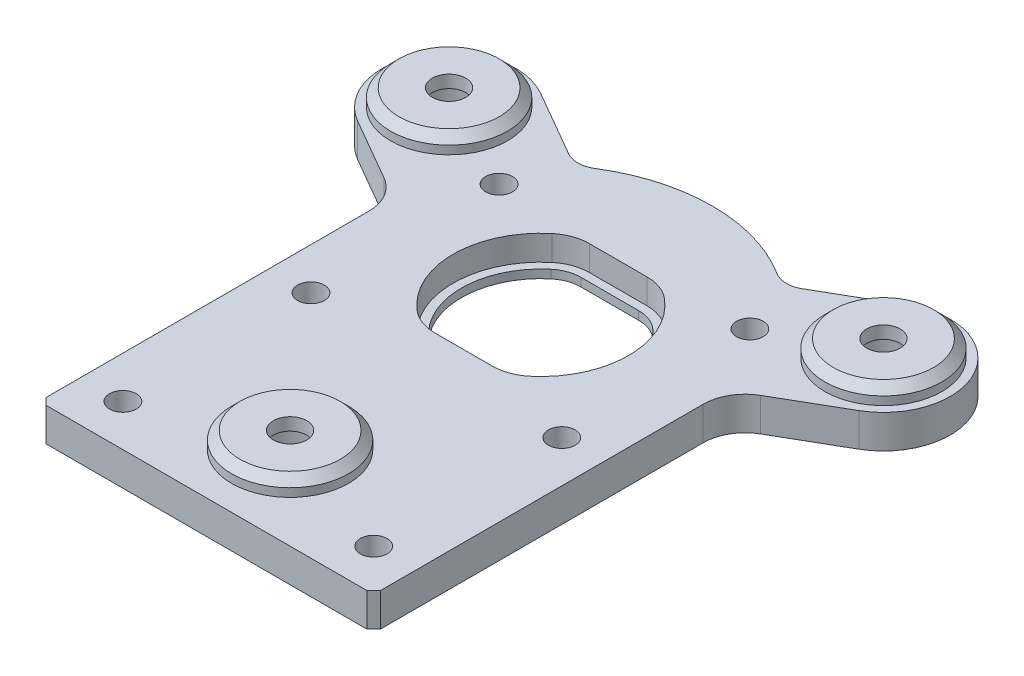
from build123d import *

# Parameters (mm, degrees)
BOSS_EXTRUDE1_DEPTH                                = 4
CUT_EXTRUDE1_DEPTH                                 = 3
CUT_EXTRUDE2_DEPTH                                 = 58.329679868
F_3_2_3_2_DIAMETER_HOLE1_D                         = 3.2
F_3_2_3_2_DIAMETER_HOLE1_DEPTH                     = 6
CBORE_FOR_M3_5_HEX_HEAD_MACHINE_SCREW1_D           = 4
CBORE_FOR_M3_5_HEX_HEAD_MACHINE_SCREW1_CBORE_D     = 8
CBORE_FOR_M3_5_HEX_HEAD_MACHINE_SCREW1_CBORE_DEPTH = 4.5
CHAMFER1_SIZE                                      = 1.55
CHAMFER2_SIZE                                      = 0.799999982
CHAMFER2_SIZE2                                     = 0.800000027
CHAMFER3_SIZE                                      = 0.799999997
CHAMFER3_SIZE2                                     = 0.800000017
FILLET1_R                                          = 3
FILLET2_R                                          = 4.1
FILLET3_R                                          = 5
FILLET4_R                                          = 5.100000015


with BuildPart() as part:
    # Sketch1 → Boss-Extrude1 (new body)
    with BuildSketch(Plane(origin=(0, 4, 0), x_dir=(1, 0, 0), z_dir=(0, 1, 0))):
        with BuildLine():
            Line((19.999999925, -16.999999746), (19.999999925, 25.309401343))
            Line((19.999999925, 25.309401343), (29.980761952, 31.071796677))
            ThreePointArc((29.980761952, 31.071796677), (32.90896539, 41.999999919), (21.980762114, 44.92820323))
            Line((21.980762114, 44.92820323), (12.345871038, 39.365496274))
            ThreePointArc((12.345871038, 39.365496274), (0, 43.5), (-12.345871038, 39.365496274))
            Line((-12.345871038, 39.365496274), (-21.980762114, 44.92820323))
            ThreePointArc((-21.980762114, 44.92820323), (-32.908965409, 41.999999887), (-29.980761888, 31.071796639))
            Line((-29.980761888, 31.071796639), (-19.999999289, 25.3094011))
            Line((-19.999999289, 25.3094011), (-19.999999289, -16.999999746))
            Line((-19.999999289, -16.999999746), (19.999999925, -16.999999746))
        make_face()
    extrude(amount=-BOSS_EXTRUDE1_DEPTH)

    # Sketch2 → Cut-Extrude1 (cut)
    with BuildSketch(Plane(origin=(0, 4, 0), x_dir=(-1, 0, 0), z_dir=(0, 1, 0))):
        with BuildLine():
            Line((-4.968651732, -32.250000015), (4.968651732, -32.250000015))
            ThreePointArc((4.968651732, -32.250000015), (10.500000015, -23), (4.968651732, -13.749999985))
            Line((4.968651732, -13.749999985), (-4.968651732, -13.749999985))
            ThreePointArc((-4.968651732, -13.749999985), (-10.500000015, -23), (-4.968651732, -32.250000015))
        make_face()
    extrude(amount=-CUT_EXTRUDE1_DEPTH, mode=Mode.SUBTRACT)

    # Sketch3 → Cut-Extrude2 (cut, through all)
    with BuildSketch(Plane.XZ):
        with BuildLine():
            Line((4.71036092, -14.75), (-4.71036092, -14.75))
            ThreePointArc((-4.71036092, -14.75), (-9.5, -23), (-4.71036092, -31.25))
            Line((-4.71036092, -31.25), (4.71036092, -31.25))
            ThreePointArc((4.71036092, -31.25), (9.5, -23), (4.71036092, -14.75))
        make_face()
    extrude(amount=-CUT_EXTRUDE2_DEPTH, mode=Mode.SUBTRACT)

    # Sketch4 → Revolve1 (revolve)
    with BuildSketch(Plane(origin=(0, 0, -38), x_dir=(-1, 0, 0), z_dir=(0, 0, -1)), mode=Mode.PRIVATE) as revolve1_sk:
        Polygon((18.980762114, 4), (25.980762114, 4), (25.980762114, 6), (19.980762114, 6), (18.980762114, 5), align=None)
    revolve(revolve1_sk.sketch.rotate(Axis((-25.980762114, 4, -38), (0, 1, 0)), 270), axis=Axis((-25.980762114, 4, -38), (0, 1, 0)))

    # Sketch5 → Revolve2 (revolve)
    with BuildSketch(Plane(origin=(0, 0, 7), x_dir=(-1, 0, 0), z_dir=(0, 0, -1)), mode=Mode.PRIVATE) as revolve2_sk:
        Polygon((-7, 4), (0, 4), (0, 6), (-6, 6), (-7, 5), align=None)
    revolve(revolve2_sk.sketch.rotate(Axis((0, 4, 7), (0, 1, 0)), 180), axis=Axis((0, 4, 7), (0, 1, 0)))

    # Sketch6 → Revolve3 (revolve)
    with BuildSketch(Plane(origin=(0, 0, -38), x_dir=(-1, 0, 0), z_dir=(0, 0, -1)), mode=Mode.PRIVATE) as revolve3_sk:
        Polygon((-32.980762114, 4), (-25.980762114, 4), (-25.980762114, 6), (-31.980762114, 6), (-32.980762114, 5), align=None)
    revolve(revolve3_sk.sketch.rotate(Axis((25.980762114, 4, -38), (0, 1, 0)), 270), axis=Axis((25.980762114, 4, -38), (0, 1, 0)))

    # Ø3.2 (3.2) Diameter Hole1
    with Locations(Plane(origin=(0, 0, 0), x_dir=(-1, 0, 0), z_dir=(0, -1, 0))):
        with Locations((15.000000337, 33.000000191), (-14.999999663, 10.500000191), (15.000000337, -11.999999809), (-14.999999663, -11.999999809), (15.000000337, 10.500000191), (-14.999999663, 33.000000191)):
            Hole(F_3_2_3_2_DIAMETER_HOLE1_D / 2, depth=F_3_2_3_2_DIAMETER_HOLE1_DEPTH)

    # CBORE for M3.5 Hex Head Machine Screw1 (through all)
    with Locations(Plane(origin=(0, 0, 0), x_dir=(-1, 0, 0), z_dir=(0, -1, 0))):
        with Locations((0, -7), (-25.980762114, 38), (25.980762114, 38)):
            CounterBoreHole(CBORE_FOR_M3_5_HEX_HEAD_MACHINE_SCREW1_D / 2, CBORE_FOR_M3_5_HEX_HEAD_MACHINE_SCREW1_CBORE_D / 2, CBORE_FOR_M3_5_HEX_HEAD_MACHINE_SCREW1_CBORE_DEPTH)

    # Chamfer1
    chamfer1_edges = [part.edges().sort_by_distance(p)[0] for p in [
        (13.399999663, 0, -10.500000191),
        (-16.600000337, 0, -33.000000191),
        (13.399999663, 0, -33.000000191),
        (-16.600000337, 0, -10.500000191),
        (13.399999663, 0, 11.999999809),
        (-16.600000337, 0, 11.999999809),
    ]]
    chamfer(chamfer1_edges, length=CHAMFER1_SIZE)

    # Chamfer2
    chamfer2_edges = [part.edges().sort_by_distance(p)[0] for p in [
        (-19.999999289, 2, 16.999999746),
    ]]
    chamfer2_side = [part.faces().sort_by_distance(p)[0] for p in [
        (3.18e-07, 2, 16.999999746),
    ]]
    chamfer(chamfer2_edges, length=CHAMFER2_SIZE, length2=CHAMFER2_SIZE2, reference=chamfer2_side[0])

    # Chamfer3
    chamfer3_edges = [part.edges().sort_by_distance(p)[0] for p in [
        (19.999999925, 2, 16.999999746),
    ]]
    chamfer3_side = [part.faces().sort_by_distance(p)[0] for p in [
        (0.400000309, 2, 16.999999746),
    ]]
    chamfer(chamfer3_edges, length=CHAMFER3_SIZE, length2=CHAMFER3_SIZE2, reference=chamfer3_side[0])

    # Fillet1
    fillet1_edges = [part.edges().sort_by_distance(p)[0] for p in [
        (-12.345871038, 2, -39.365496274),
        (12.345871038, 2, -39.365496274),
    ]]
    fillet(fillet1_edges, radius=FILLET1_R)

    # Fillet2
    fillet2_edges = [part.edges().sort_by_distance(p)[0] for p in [
        (4.71036092, 0.5, -14.75),
        (4.71036092, 0.5, -31.25),
        (-4.71036092, 0.5, -31.25),
        (-4.71036092, 0.5, -14.75),
    ]]
    fillet(fillet2_edges, radius=FILLET2_R)

    # Fillet3
    fillet3_edges = [part.edges().sort_by_distance(p)[0] for p in [
        (-19.999999289, 2, -25.3094011),
        (19.999999925, 2, -25.309401343),
    ]]
    fillet(fillet3_edges, radius=FILLET3_R)

    # Fillet4
    fillet4_edges = [part.edges().sort_by_distance(p)[0] for p in [
        (4.968651732, 2.5, -32.250000015),
        (4.968651732, 2.5, -13.749999985),
        (-4.968651732, 2.5, -13.749999985),
        (-4.968651732, 2.5, -32.250000015),
    ]]
    fillet(fillet4_edges, radius=FILLET4_R)


solid = part.part
